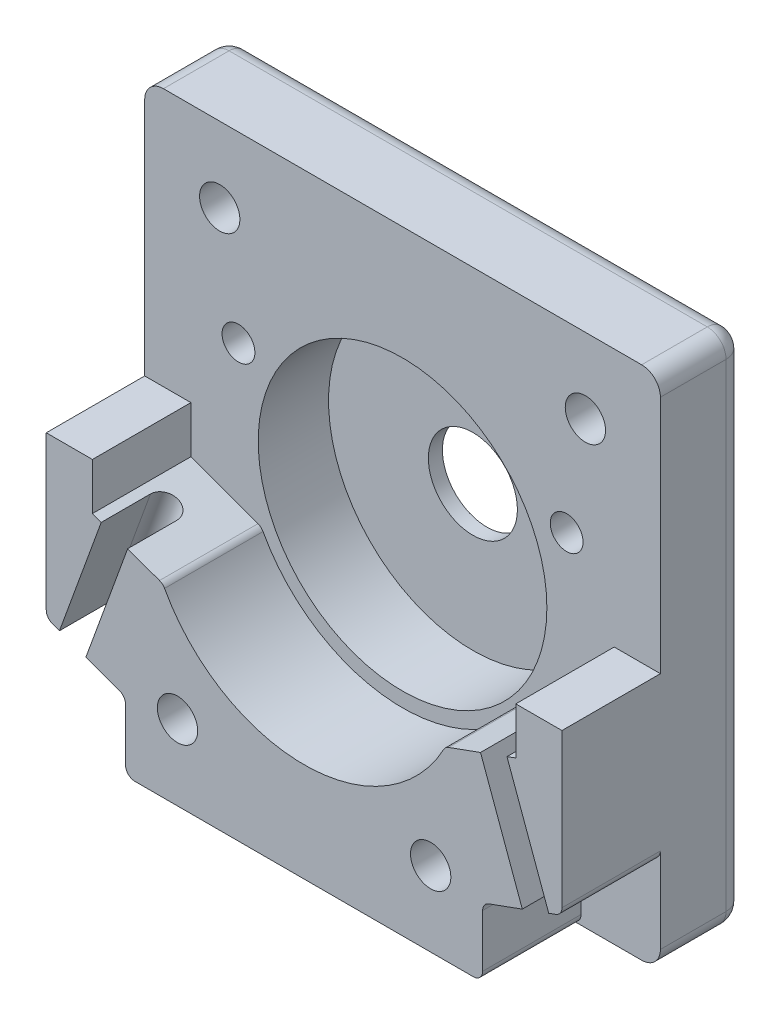
from build123d import *

# Parameters (mm, degrees)
SKETCH1_W           = 55
SKETCH1_H           = 55
SKETCH1_R           = 4.75
SKETCH1_R_2         = 2.15
BOSS_EXTRUDE1_DEPTH = 19.5
CUT_EXTRUDE10_DEPTH = 3.5
SKETCH5_R           = 15.392304845
CUT_EXTRUDE2_DEPTH  = 18
SKETCH6_OUTSIDE_W   = 73.038
SKETCH6_OUTSIDE_H   = 73.038
CUT_EXTRUDE3_DEPTH  = 10.5
SKETCH7_R           = 1.75
CUT_EXTRUDE4_DEPTH  = 9
CUT_EXTRUDE6_REACH  = 73.751
CUT_EXTRUDE11_REACH = 86.299
FILLET2_R           = 2
FILLET3_R           = 1


with BuildPart() as part:
    # Sketch1 → Boss-Extrude1 (new body)
    with BuildSketch(Plane.XY):
        with Locations((27.5, 27.5)):
            Rectangle(SKETCH1_W, SKETCH1_H)
        with Locations((27.5, 27.5)):
            Circle(SKETCH1_R, mode=Mode.SUBTRACT)
        with Locations((8, 47)):
            Circle(SKETCH1_R_2, mode=Mode.SUBTRACT)
        with Locations((47, 47)):
            Circle(SKETCH1_R_2, mode=Mode.SUBTRACT)
        with Locations((41, 8)):
            Circle(SKETCH1_R_2, mode=Mode.SUBTRACT)
        with Locations((14, 8)):
            Circle(SKETCH1_R_2, mode=Mode.SUBTRACT)
    extrude(amount=BOSS_EXTRUDE1_DEPTH)

    # Sketch11 → Cut-Extrude10 (cut)
    with BuildSketch(Plane.XY):
        Polygon((10.049593456, 50.55), (5.950406544, 50.55), (3.900813089, 47), (5.950406544, 43.45), (10.049593456, 43.45), (12.099186911, 47), align=None)
        Polygon((42.900813089, 47), (44.950406544, 50.55), (49.049593456, 50.55), (51.099186911, 47), (49.049593456, 43.45), (44.950406544, 43.45), align=None)
        Polygon((38.950406544, 11.55), (43.049593456, 11.55), (45.099186911, 8), (43.049593456, 4.45), (38.950406544, 4.45), (36.900813089, 8), align=None)
        Polygon((11.950406544, 11.55), (16.049593456, 11.55), (18.099186911, 8), (16.049593456, 4.45), (11.950406544, 4.45), (9.900813089, 8), align=None)
    extrude(amount=CUT_EXTRUDE10_DEPTH, mode=Mode.SUBTRACT)

    # Sketch5 → Cut-Extrude2 (cut)
    with BuildSketch(Plane.XY.offset(19.5)):
        with Locations((27.5, 27.5)):
            Circle(SKETCH5_R)
    extrude(amount=-CUT_EXTRUDE2_DEPTH, mode=Mode.SUBTRACT)

    # Sketch6 outside → Cut-Extrude3 (cut)
    with BuildSketch(Plane.XY.offset(19.5)):
        with Locations((27.5, 27.5)):
            Rectangle(SKETCH6_OUTSIDE_W, SKETCH6_OUTSIDE_H)
        with BuildLine():
            Line((12.44308051, 19.732705171), (4.925539544, 22.468866318))
            Line((4.925539544, 22.468866318), (4.925539544, 27.468866318))
            Line((4.925539544, 27.468866318), (0, 27.468866318))
            Line((0, 27.468866318), (0, 10.397959841))
            Line((0, 10.397959841), (8.457233587, 7.319778551))
            Line((8.457233587, 7.319778551), (8.457233587, 0))
            Line((8.457233587, 0), (46.542766413, 0))
            Line((46.542766413, 0), (46.542766413, 7.319778551))
            Line((46.542766413, 7.319778551), (55, 10.397959841))
            Line((55, 10.397959841), (55, 27.468866318))
            Line((55, 27.468866318), (50.074460456, 27.468866318))
            Line((50.074460456, 27.468866318), (50.074460456, 22.468866318))
            Line((50.074460456, 22.468866318), (42.55691949, 19.732705171))
            ThreePointArc((42.55691949, 19.732705171), (27.5, 10.557695155), (12.44308051, 19.732705171))
        make_face(mode=Mode.SUBTRACT)
    extrude(amount=-CUT_EXTRUDE3_DEPTH, mode=Mode.SUBTRACT)

    # Sketch7 → Cut-Extrude4 (cut)
    with BuildSketch(Plane.XY):
        with Locations((10, 35.5)):
            Circle(SKETCH7_R)
        with Locations((45, 35.5)):
            Circle(SKETCH7_R)
    extrude(amount=CUT_EXTRUDE4_DEPTH, mode=Mode.SUBTRACT)

    # Sketch9 → Cut-Extrude6 (cut, up to next)
    with BuildSketch(Plane(origin=(3.341839876, 9.181629599, 0), x_dir=(0, 0, 1), z_dir=(-0.3420201433256653, -0.9396926207859098, 0)), mode=Mode.PRIVATE) as cut_extrude6_sk1:
        with BuildLine():
            Line((14.25, 2.056311715), (19.5, 2.056311715))
            Line((19.5, 2.056311715), (19.5, -0.943688285))
            Line((19.5, -0.943688285), (14.25, -0.943688285))
            ThreePointArc((14.25, -0.943688285), (12.75, 0.556311715), (14.25, 2.056311715))
        make_face()
    cut_extrude6_tool1 = extrude(cut_extrude6_sk1.sketch, amount=-CUT_EXTRUDE6_REACH, mode=Mode.PRIVATE) & part.part
    add(cut_extrude6_tool1.solids().sort_by_distance((2.819078, 9.371899, 16.277233))[0], mode=Mode.SUBTRACT)

    # Sketch10 → Cut-Extrude11 (cut, up to next)
    with BuildSketch(Plane(origin=(3.091937938, -8.495029668, 0), x_dir=(0, 0, -1), z_dir=(0.3420201433256654, -0.9396926207859098, 0)), mode=Mode.PRIVATE) as cut_extrude11_sk1:
        with BuildLine():
            Line((-14.25, 53.739405858), (-19.5, 53.739405858))
            Line((-19.5, 53.739405858), (-19.5, 50.739405858))
            Line((-19.5, 50.739405858), (-14.25, 50.739405858))
            ThreePointArc((-14.25, 50.739405858), (-12.75, 52.239405858), (-14.25, 53.739405858))
        make_face()
    cut_extrude11_tool1 = extrude(cut_extrude11_sk1.sketch, amount=-CUT_EXTRUDE11_REACH, mode=Mode.PRIVATE) & part.part
    add(cut_extrude11_tool1.solids().sort_by_distance((52.180922, 9.371899, 16.277233))[0], mode=Mode.SUBTRACT)

    # Fillet2
    fillet2_edges = [part.edges().sort_by_distance(p)[0] for p in [
        (0, 55, 4.5),
        (55, 55, 4.5),
        (55, 0, 4.5),
        (0, 0, 4.5),
        (27.5, 55, 0),
        (55, 27.5, 0),
        (27.5, 0, 0),
        (0, 27.5, 0),
    ]]
    fillet(fillet2_edges, radius=FILLET2_R)

    # Fillet3
    fillet3_edges = [part.edges().sort_by_distance(p)[0] for p in [
        (0, 10.397959841, 14.25),
        (12.44308051, 19.732705171, 14.25),
        (42.55691949, 19.732705171, 14.25),
        (55, 10.397959841, 14.25),
        (46.542766413, 7.319778551, 14.25),
        (46.542766413, 0, 14.25),
        (8.457233587, 0, 14.25),
        (8.457233587, 7.319778551, 14.25),
    ]]
    fillet(fillet3_edges, radius=FILLET3_R)


solid = part.part
